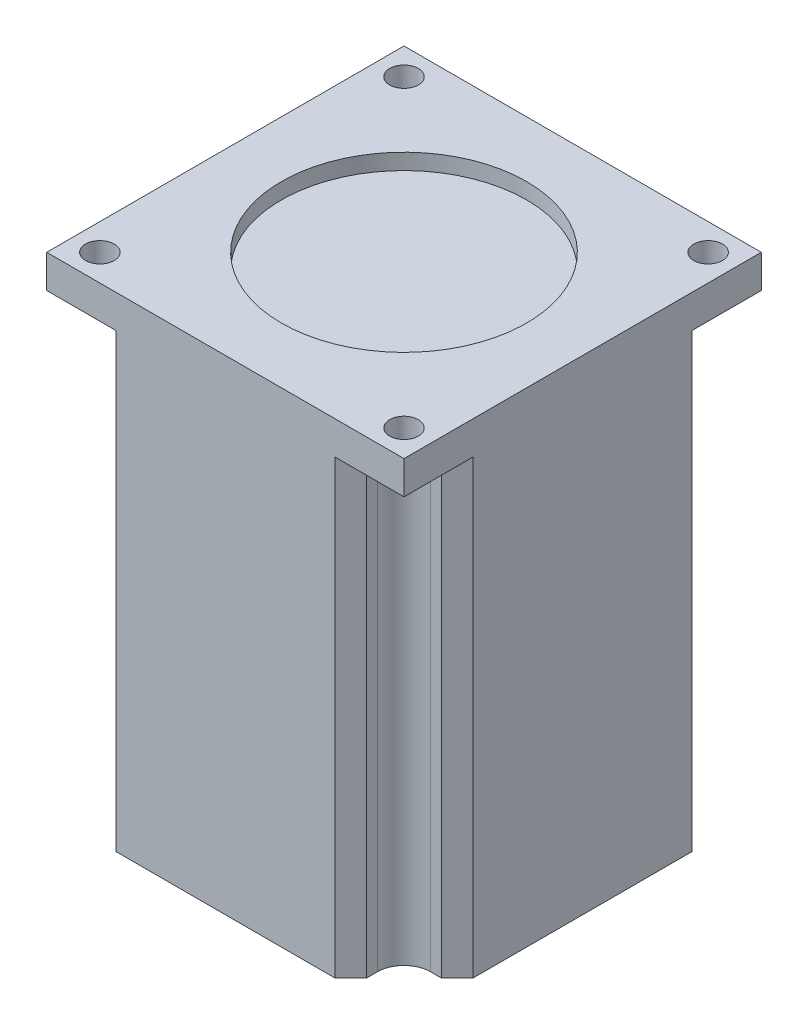
from build123d import *

# Parameters (mm, degrees)
CROQUIS1_W                                 = 56.1
CROQUIS1_H                                 = 56.1
SALIENTE_EXTRUIR1_DEPTH                    = 76.05
CORTAR_EXTRUIR1_DEPTH                      = 82.199307263
SIMETR_A3_AT_THE_SECOND_PLANE_COPY_1_DEPTH = 82.199307263
CHAFL_N1_SIZE                              = 2.5
CROQUIS3_R                                 = 2.25
CORTAR_EXTRUIR2_DEPTH                      = 82.199307263
SIMETR_A4_AT_THE_SECOND_PLANE_COPY_1_SKE_R = 2.25
SIMETR_A4_AT_THE_SECOND_PLANE_COPY_1_DEPTH = 82.199307263
CROQUIS4_R                                 = 19.25
CORTAR_EXTRUIR3_DEPTH                      = 2.5


with BuildPart() as part:
    # Croquis1 → Saliente-Extruir1 (new body)
    with BuildSketch(Plane(origin=(0, 0, 0), x_dir=(1, 0, 0), z_dir=(0, 1, 0))):
        Rectangle(CROQUIS1_W, CROQUIS1_H)
    extrude(amount=SALIENTE_EXTRUIR1_DEPTH)

    # Croquis2 → Cortar-Extruir1 (cut, through all)
    with BuildSketch(Plane(origin=(0, 70.85, 0), x_dir=(1, 0, 0), z_dir=(0, 1, 0))):
        with BuildLine():
            Line((-28.05, 19.7), (-23.875, 19.7))
            ThreePointArc((-23.875, 19.7), (-20.922829189, 20.922829189), (-19.7, 23.875))
            Line((-19.7, 23.875), (-19.7, 28.05))
            Line((-19.7, 28.05), (-28.05, 28.05))
            Line((-28.05, 28.05), (-28.05, 19.7))
        make_face()
    cortar_extruir1 = extrude(amount=-CORTAR_EXTRUIR1_DEPTH, mode=Mode.SUBTRACT)

    # Simetría3: Cortar-Extruir1 across plane
    add(cortar_extruir1.mirror(Plane(origin=(0, 0, 0), x_dir=(0, 0, 1), z_dir=(1, 0, 0))), mode=Mode.SUBTRACT)

    # Simetría3 at the second plane: Cortar-Extruir1 across plane
    add(cortar_extruir1.mirror(Plane.XY), mode=Mode.SUBTRACT)

    # Simetría3 at the second plane copy 1 ske → Simetría3 at the second plane copy 1 (cut, through all)
    with BuildSketch(Plane(origin=(0, 70.85, 0), x_dir=(-1, 0, 0), z_dir=(0, 1, 0))):
        with BuildLine():
            Line((-28.05, 19.7), (-23.875, 19.7))
            ThreePointArc((-23.875, 19.7), (-20.922829189, 20.922829189), (-19.7, 23.875))
            Line((-19.7, 23.875), (-19.7, 28.05))
            Line((-19.7, 28.05), (-28.05, 28.05))
            Line((-28.05, 28.05), (-28.05, 19.7))
        make_face()
    extrude(amount=-SIMETR_A3_AT_THE_SECOND_PLANE_COPY_1_DEPTH, mode=Mode.SUBTRACT)

    # Chaflán1
    chafl_n1_edges = [part.edges().sort_by_distance(p)[0] for p in [
        (-28.05, 35.425, -19.7),
        (-19.7, 35.425, -28.05),
        (-28.05, 35.425, 19.7),
        (-19.7, 35.425, 28.05),
        (28.05, 35.425, -19.7),
        (19.7, 35.425, -28.05),
        (28.05, 35.425, 19.7),
        (19.7, 35.425, 28.05),
    ]]
    chamfer(chafl_n1_edges, length=CHAFL_N1_SIZE)

    # Croquis3 → Cortar-Extruir2 (cut, through all)
    with BuildSketch(Plane.XZ.offset(-70.85)):
        with Locations(Location((23.875, -23.875, 0), (0, 0, 270))):
            Circle(CROQUIS3_R)
    cortar_extruir2 = extrude(amount=-CORTAR_EXTRUIR2_DEPTH, mode=Mode.SUBTRACT)

    # Simetría4: Cortar-Extruir2 across plane
    add(cortar_extruir2.mirror(Plane(origin=(0, 0, 0), x_dir=(0, 0, 1), z_dir=(1, 0, 0))), mode=Mode.SUBTRACT)

    # Simetría4 at the second plane: Cortar-Extruir2 across plane
    add(cortar_extruir2.mirror(Plane.XY), mode=Mode.SUBTRACT)

    # Simetría4 at the second plane copy 1 ske → Simetría4 at the second plane copy 1 (cut, through all)
    with BuildSketch(Plane(origin=(0, 70.85, 0), x_dir=(-1, 0, 0), z_dir=(0, -1, 0))):
        with Locations(Location((23.875, -23.875, 0), (0, 0, 270))):
            Circle(SIMETR_A4_AT_THE_SECOND_PLANE_COPY_1_SKE_R)
    extrude(amount=-SIMETR_A4_AT_THE_SECOND_PLANE_COPY_1_DEPTH, mode=Mode.SUBTRACT)

    # Croquis4 → Cortar-Extruir3 (cut)
    with BuildSketch(Plane(origin=(0, 76.05, 0), x_dir=(1, 0, 0), z_dir=(0, 1, 0))):
        with Locations(Location((0, 0, 0), (0, 0, 270))):
            Circle(CROQUIS4_R)
    extrude(amount=-CORTAR_EXTRUIR3_DEPTH, mode=Mode.SUBTRACT)


solid = part.part
